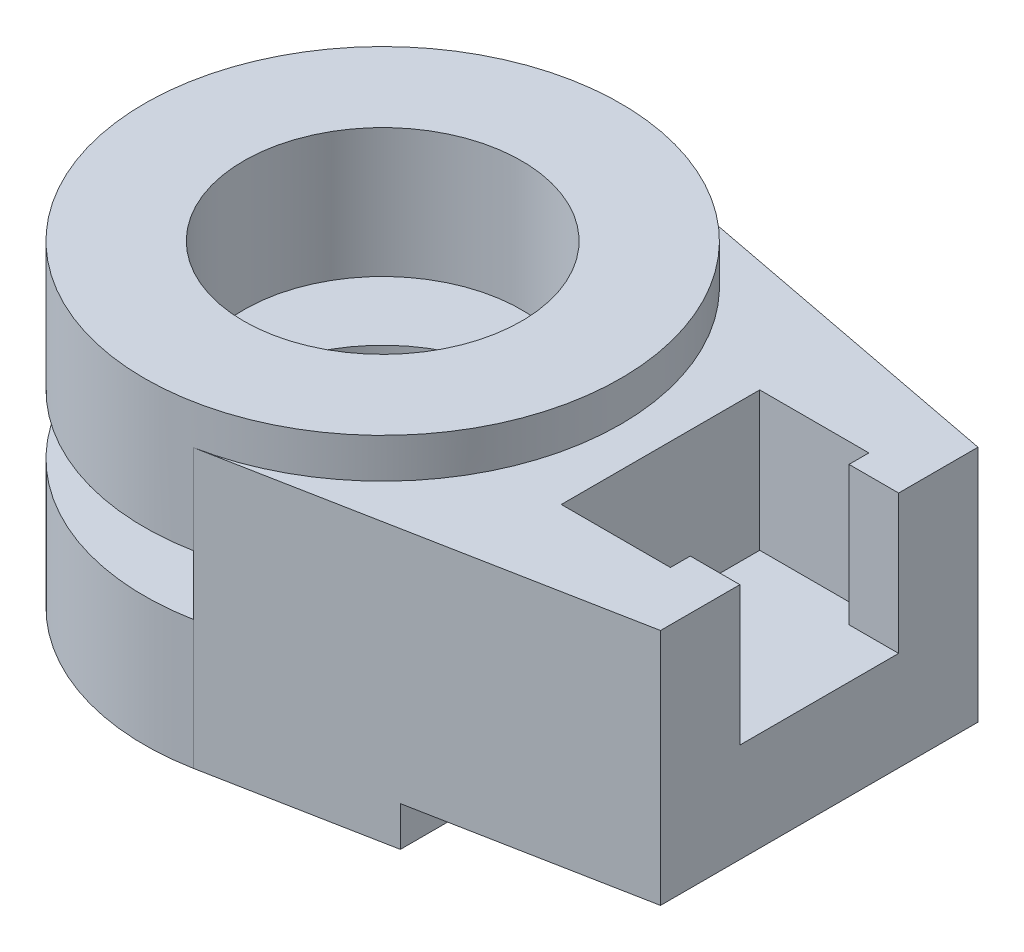
from build123d import *

# Parameters (mm, degrees)
SKETCH_1_R          = 48
EXTRUDE_1_DEPTH     = 64
CUT_EXTRUDE_1_DEPTH = 67
EXTRUDE_START       = -56
EXTRUDE_2_DEPTH     = 56
CUT_EXTRUDE_2_DEPTH = 28
SKETCH_5_W          = 44
SKETCH_5_H          = 8
CUT_EXTRUDE_3_DEPTH = 54
SKETCH_6_R          = 28
CUT_EXTRUDE_4_DEPTH = 119.928549979


with BuildPart() as part:
    # 草圖1 → 填料-伸長1 (new body)
    with BuildSketch(Plane(origin=(0, 0, 0), x_dir=(1, 0, 0), z_dir=(0, 1, 0))):
        with Locations(Location((0, 0, 0), (0, 0, 270))):
            Circle(SKETCH_1_R)
    extrude(amount=EXTRUDE_1_DEPTH)

    # 草圖2 → 除料-伸長1 (cut, symmetric)
    with BuildSketch(Plane.XY):
        with BuildLine():
            Line((-48, 38), (12, 38))
            ThreePointArc((12, 38), (18, 32), (12, 26))
            Line((12, 26), (-48, 26))
            Line((-48, 26), (-48, 38))
        make_face()
    extrude(amount=CUT_EXTRUDE_1_DEPTH, both=True, mode=Mode.SUBTRACT)

    # 草圖3 → 填料-伸長2 (add)
    with BuildSketch(Plane(origin=(0, 56, 0), x_dir=(1, 0, 0), z_dir=(0, 1, 0)).offset(EXTRUDE_START)):
        with BuildLine():
            Line((88, -32), (88, 32))
            Line((88, 32), (9.03959037, 47.141126481))
            ThreePointArc((9.03959037, 47.141126481), (48, 0), (9.03959037, -47.141126481))
            Line((9.03959037, -47.141126481), (88, -32))
        make_face()
    extrude(amount=EXTRUDE_2_DEPTH)

    # 草圖4 → 除料-伸長2 (cut)
    with BuildSketch(Plane(origin=(0, 56, 0), x_dir=(1, 0, 0), z_dir=(0, 1, 0))):
        Polygon((88, -16), (88, 16), (78, 16), (78, 20), (56, 20), (56, -20), (78, -20), (78, -16), align=None)
    extrude(amount=-CUT_EXTRUDE_2_DEPTH, mode=Mode.SUBTRACT)

    # 草圖5 → 除料-伸長3 (cut, symmetric)
    with BuildSketch(Plane.XY):
        with Locations((66, 4)):
            Rectangle(SKETCH_5_W, SKETCH_5_H)
    extrude(amount=CUT_EXTRUDE_3_DEPTH, both=True, mode=Mode.SUBTRACT)

    # 草圖6 → 除料-伸長4 (cut, through all)
    with BuildSketch(Plane(origin=(0, 64, 0), x_dir=(1, 0, 0), z_dir=(0, 1, 0))):
        with Locations(Location((0, 0, 0), (0, 0, 270))):
            Circle(SKETCH_6_R)
    extrude(amount=-CUT_EXTRUDE_4_DEPTH, mode=Mode.SUBTRACT)


solid = part.part
